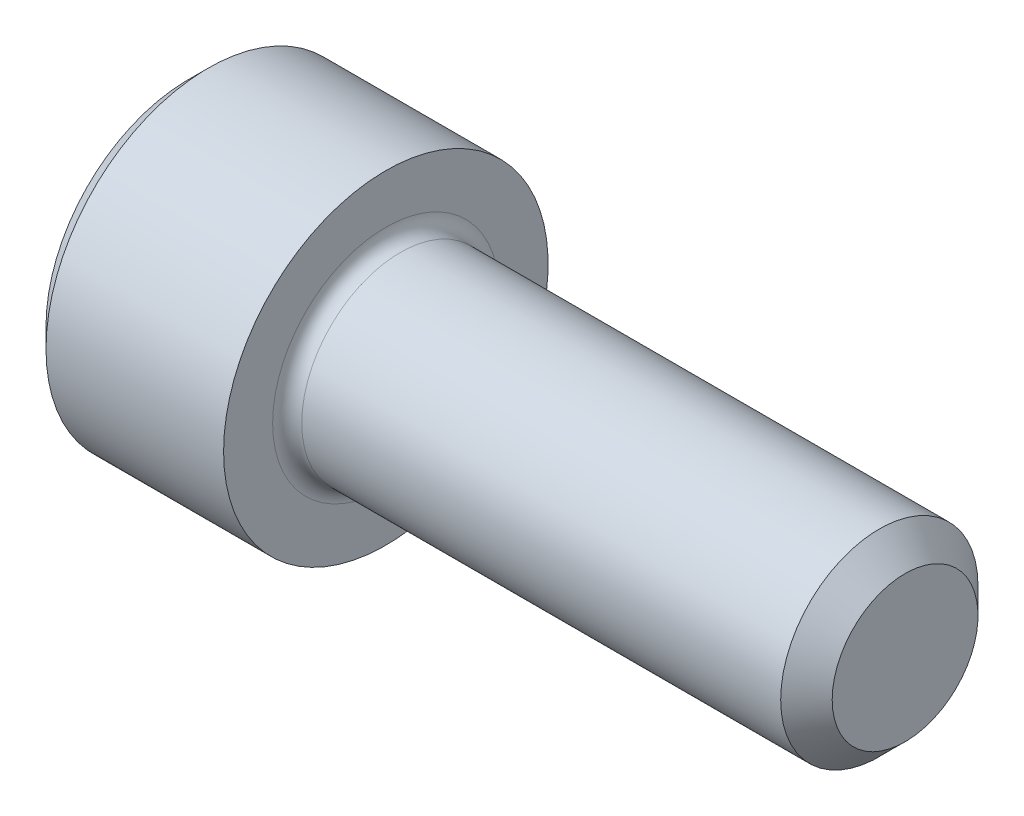
from build123d import *

# Parameters (mm, degrees)
FILLET1_R   = 0.3556
HEX_2_DEPTH = 2.286


with BuildPart() as part:
    # BodySke → Base-Revolve (revolve)
    with BuildSketch(Plane.XY, mode=Mode.PRIVATE) as base_revolve_sk:
        Polygon((0, 0), (0, 3.48615), (0.4826, 3.96875), (4.826, 3.96875), (4.826, 2.413), (16.89608, 2.413), (17.526, 1.78308), (17.526, 0), align=None)
    revolve(base_revolve_sk.sketch.rotate(Axis((-31.75, 0, 0), (1, 0, 0)), 90), axis=Axis((-31.75, 0, 0), (1, 0, 0)))

    # Fillet1
    fillet1_edges = [part.edges().sort_by_distance(p)[0] for p in [
        (4.826, 0, -2.413),
    ]]
    fillet(fillet1_edges, radius=FILLET1_R)

    # Sketch2 → Hex-PreBroach (revolve, cut)
    with BuildSketch(Plane.XY, mode=Mode.PRIVATE) as hex_prebroach_sk:
        Polygon((0, 1.98501), (2.286, 1.98501), (3.432046058, 0), (0, 0), align=None)
    revolve(hex_prebroach_sk.sketch.rotate(Axis((0, 0, 0), (1, 0, 0)), 90), axis=Axis((0, 0, 0), (1, 0, 0)), mode=Mode.SUBTRACT)

    # Sketch3 → Hex 2 (cut)
    with BuildSketch(Plane(origin=(0, 0, 0), x_dir=(0, 0.500000000000001, 0.866025403784438), z_dir=(-1, 0, 0))):
        Polygon((1.146046058, 1.98501), (-1.146046058, 1.98501), (-2.292092116, 0), (-1.146046058, -1.98501), (1.146046058, -1.98501), (2.292092116, 0), align=None)
    extrude(amount=-HEX_2_DEPTH, mode=Mode.SUBTRACT)


solid = part.part
